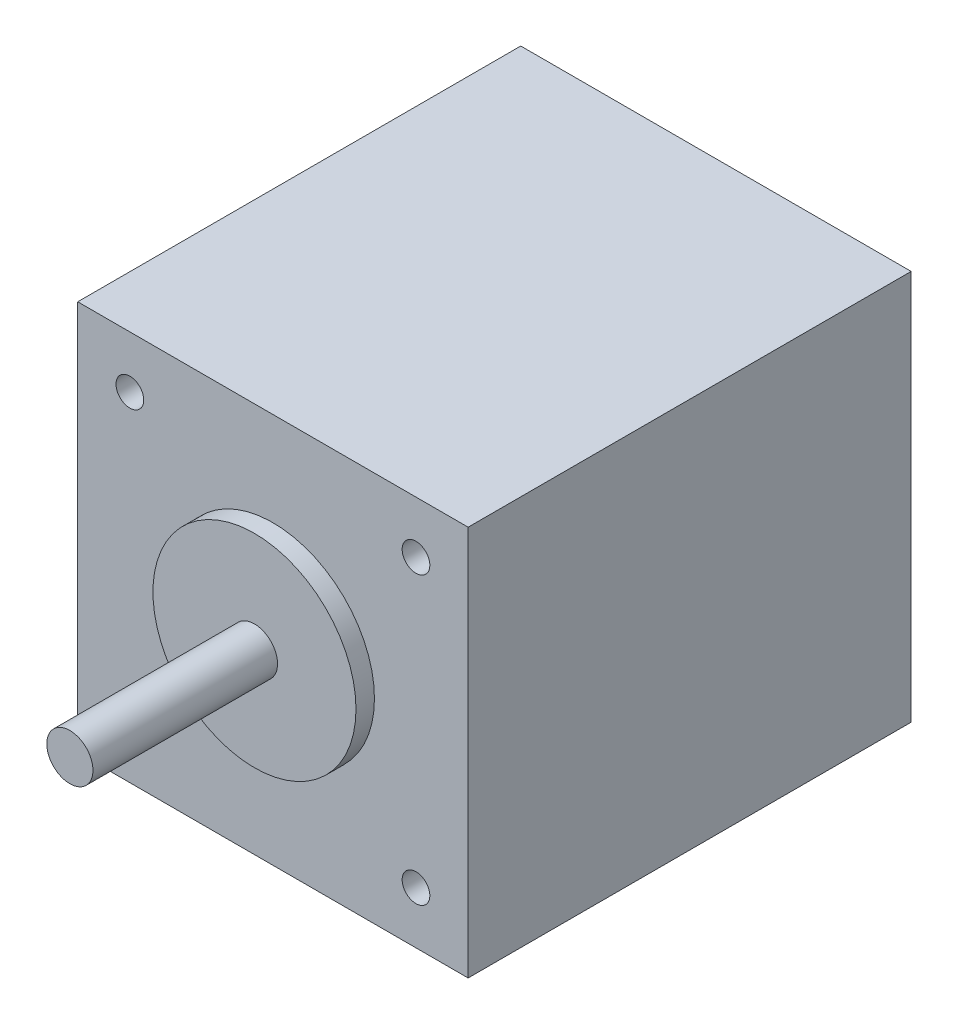
from build123d import *

# Parameters (mm, degrees)
SKIZZE1_W                       = 42.3
SKIZZE1_H                       = 42.3
AUFSATZ_LINEAR_AUSTRAGEN1_DEPTH = 48
SKIZZE2_R                       = 11
AUFSATZ_LINEAR_AUSTRAGEN2_DEPTH = 2
SKIZZE3_R                       = 2.5
AUFSATZ_LINEAR_AUSTRAGEN3_DEPTH = 20
SKIZZE4_R                       = 1.5
SCHNITT_LINEAR_AUSTRAGEN1_DEPTH = 4


with BuildPart() as part:
    # Skizze1 → Aufsatz-Linear austragen1 (new body)
    with BuildSketch(Plane.XY):
        Rectangle(SKIZZE1_W, SKIZZE1_H)
    extrude(amount=AUFSATZ_LINEAR_AUSTRAGEN1_DEPTH)

    # Skizze2 → Aufsatz-Linear austragen2 (add)
    with BuildSketch(Plane.XY.offset(48)):
        Circle(SKIZZE2_R)
    extrude(amount=AUFSATZ_LINEAR_AUSTRAGEN2_DEPTH)

    # Skizze3 → Aufsatz-Linear austragen3 (add)
    with BuildSketch(Plane.XY.offset(50)):
        Circle(SKIZZE3_R)
    extrude(amount=AUFSATZ_LINEAR_AUSTRAGEN3_DEPTH)

    # Skizze4 → Schnitt-Linear austragen1 (cut)
    with BuildSketch(Plane.XY.offset(48)):
        with Locations((-15.5, 15.5)):
            Circle(SKIZZE4_R)
        with Locations((15.5, 15.5)):
            Circle(SKIZZE4_R)
        with Locations((15.5, -15.5)):
            Circle(SKIZZE4_R)
        with Locations((-15.5, -15.5)):
            Circle(SKIZZE4_R)
    extrude(amount=-SCHNITT_LINEAR_AUSTRAGEN1_DEPTH, mode=Mode.SUBTRACT)


solid = part.part
